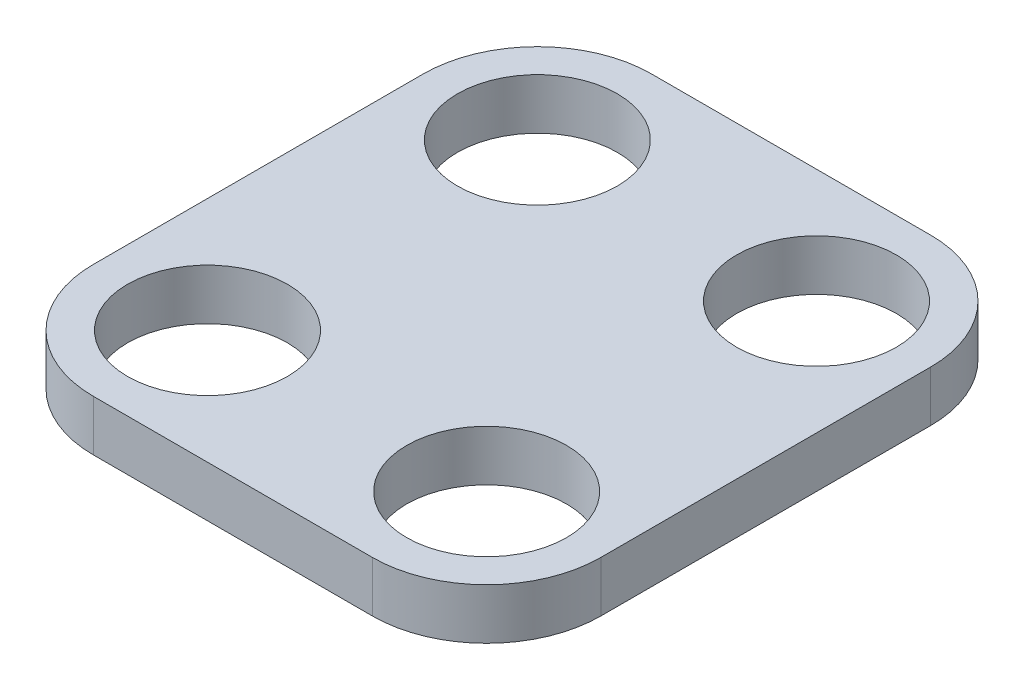
from build123d import *

# Parameters (mm, degrees)
SKETCH2_R           = 3.15
BOSS_EXTRUDE1_DEPTH = 2


with BuildPart() as part:
    # Sketch2 → Boss-Extrude1 (new body)
    with BuildSketch(Plane(origin=(0, 0, 0), x_dir=(1, 0, 0), z_dir=(0, 1, 0))):
        with BuildLine():
            Line((0.553571832, -40.497268471), (11.553571832, -40.497268471))
            ThreePointArc((11.553571832, -40.497268471), (14.735552347, -39.179248986), (16.053571832, -35.997268471))
            Line((16.053571832, -35.997268471), (16.053571832, -22.997268471))
            ThreePointArc((16.053571832, -22.997268471), (14.735552347, -19.815287955), (11.553571832, -18.497268471))
            Line((11.553571832, -18.497268471), (0.553571832, -18.497268471))
            ThreePointArc((0.553571832, -18.497268471), (-2.628408684, -19.815287955), (-3.946428168, -22.997268471))
            Line((-3.946428168, -22.997268471), (-3.946428168, -35.997268471))
            ThreePointArc((-3.946428168, -35.997268471), (-2.628408684, -39.179248986), (0.553571832, -40.497268471))
        make_face()
        with Locations(Location((11.553571832, -35.997268471, 0), (0, 0, 270))):
            Circle(SKETCH2_R, mode=Mode.SUBTRACT)
        with Locations(Location((11.553571832, -22.997268471, 0), (0, 0, 90))):
            Circle(SKETCH2_R, mode=Mode.SUBTRACT)
        with Locations(Location((0.553571832, -22.997268471, 0), (0, 0, 270))):
            Circle(SKETCH2_R, mode=Mode.SUBTRACT)
        with Locations(Location((0.553571832, -35.997268471, 0), (0, 0, 90))):
            Circle(SKETCH2_R, mode=Mode.SUBTRACT)
    extrude(amount=-BOSS_EXTRUDE1_DEPTH)


solid = part.part
